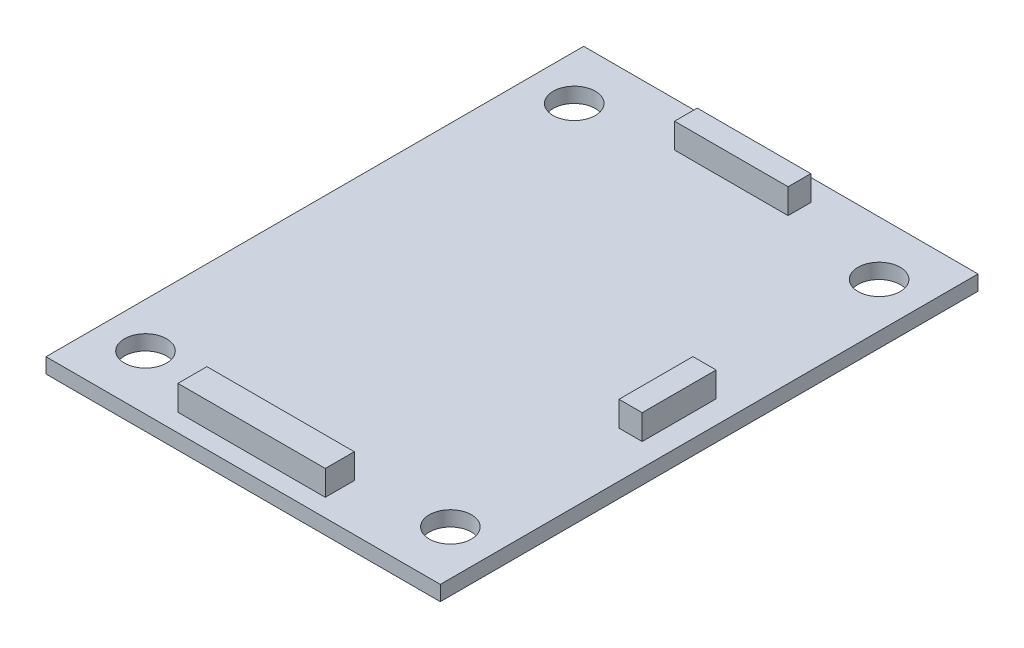
from build123d import *

# Parameters (mm, degrees)
SKETCH1_W           = 31.518490379
SKETCH1_H           = 42.979759609
SKETCH1_R           = 1.685
BOSS_EXTRUDE1_DEPTH = 1.2
SKETCH2_W           = 9.074610473
SKETCH2_H           = 1.814922095
SKETCH2_W_2         = 1.853537458
SKETCH2_H_2         = 5.908150648
SKETCH2_W_3         = 11.777685933
SKETCH2_H_3         = 2.316921823
BOSS_EXTRUDE2_DEPTH = 2


with BuildPart() as part:
    # Sketch1 → Boss-Extrude1 (new body)
    with BuildSketch(Plane(origin=(0, 0, 0), x_dir=(1, 0, 0), z_dir=(0, 1, 0))):
        with Locations((12.186773079, 17.109376158)):
            Rectangle(SKETCH1_W, SKETCH1_H)
        with Locations(Location((0, 0, 0), (0, 0, 270))):
            Circle(SKETCH1_R, mode=Mode.SUBTRACT)
        with Locations(Location((24.37, 0, 0), (0, 0, 270))):
            Circle(SKETCH1_R, mode=Mode.SUBTRACT)
        with Locations(Location((24.37, 34.27, 0), (0, 0, 270))):
            Circle(SKETCH1_R, mode=Mode.SUBTRACT)
        with Locations(Location((0, 34.27, 0), (0, 0, 270))):
            Circle(SKETCH1_R, mode=Mode.SUBTRACT)
    extrude(amount=BOSS_EXTRUDE1_DEPTH)

    # Sketch2 → Boss-Extrude2 (add)
    with BuildSketch(Plane(origin=(0, 1.2, 0), x_dir=(1, 0, 0), z_dir=(0, 1, 0))):
        with Locations((11.781311759, 35.95367365)):
            Rectangle(SKETCH2_W, SKETCH2_H)
        with Locations((25.20015065, 16.530145702)):
            Rectangle(SKETCH2_W_2, SKETCH2_H_2)
        with Locations((11.433773487, -1.792844381)):
            Rectangle(SKETCH2_W_3, SKETCH2_H_3)
    extrude(amount=BOSS_EXTRUDE2_DEPTH)


solid = part.part
